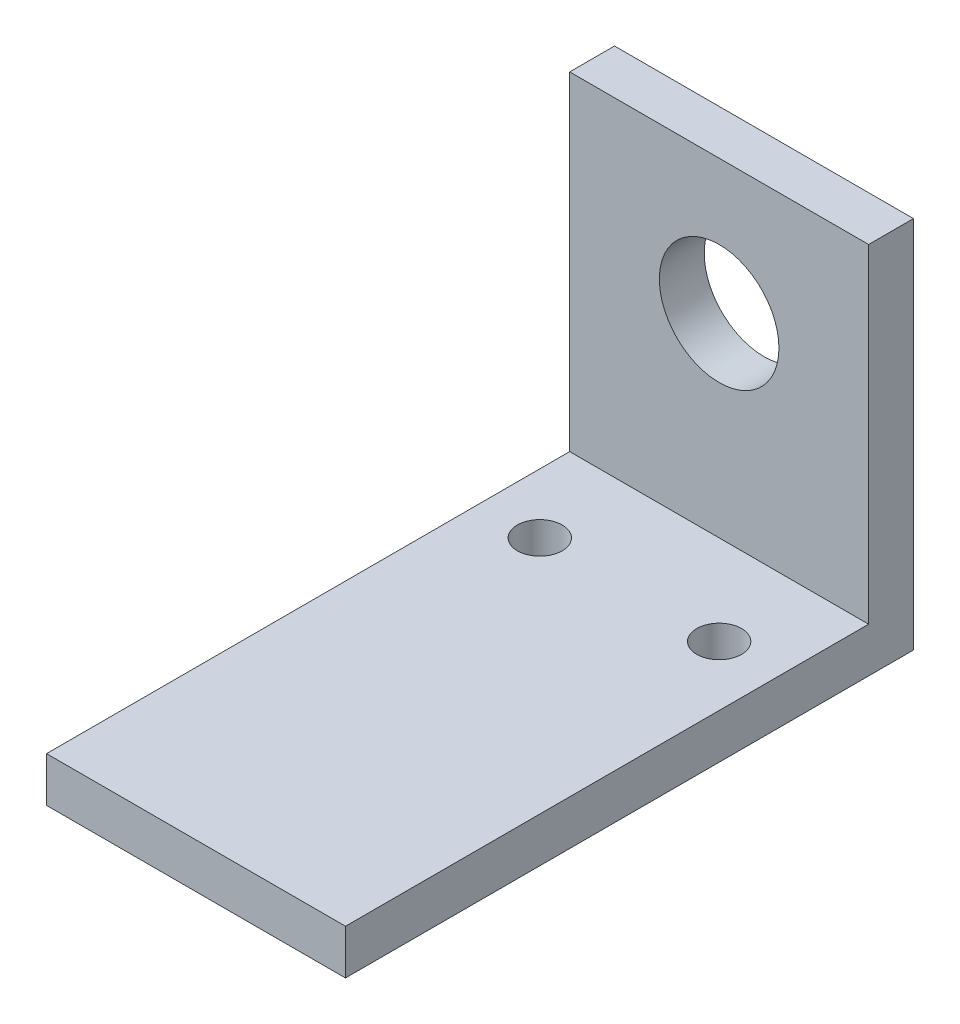
from build123d import *

# Parameters (mm, degrees)
EXTRUDE_1_DEPTH     = 20
CUT_EXTRUDE_1_REACH = 47.924
SKETCH_2_R          = 4
CUT_EXTRUDE_2_REACH = 47.924
SKETCH_3_R          = 1.5


with BuildPart() as part:
    # 草图1 → 凸台-拉伸1 (new body)
    with BuildSketch(Plane(origin=(0, 0, 0), x_dir=(0, 0, -1), z_dir=(1, 0, 0))):
        Polygon((0, 0), (0, 22), (3, 22), (3, -3), (-35, -3), (-35, 0), align=None)
    extrude(amount=EXTRUDE_1_DEPTH)

    # 草图2 → 切除-拉伸1 (cut, up to next)
    with BuildSketch(Plane.XY, mode=Mode.PRIVATE) as cut_extrude_1_sk1:
        with Locations((10, 13)):
            Circle(SKETCH_2_R)
    cut_extrude_1_tool1 = extrude(cut_extrude_1_sk1.sketch, amount=-CUT_EXTRUDE_1_REACH, mode=Mode.PRIVATE) & part.part
    add(cut_extrude_1_tool1.solids().sort_by_distance((10, 13, 0))[0], mode=Mode.SUBTRACT)

    # 草图3 → 切除-拉伸2 (cut, up to next)
    with BuildSketch(Plane(origin=(0, 0, 0), x_dir=(1, 0, 0), z_dir=(0, 1, 0)), mode=Mode.PRIVATE) as cut_extrude_2_sk1:
        with Locations(Location((4, -6, 0), (0, 0, 270))):
            Circle(SKETCH_3_R)
    cut_extrude_2_tool1 = extrude(cut_extrude_2_sk1.sketch, amount=-CUT_EXTRUDE_2_REACH, mode=Mode.PRIVATE) & part.part
    # 草图3 → 切除-拉伸2 (cut, up to next)
    with BuildSketch(Plane(origin=(0, 0, 0), x_dir=(1, 0, 0), z_dir=(0, 1, 0)), mode=Mode.PRIVATE) as cut_extrude_2_sk2:
        with Locations(Location((16, -6, 0), (0, 0, 270))):
            Circle(SKETCH_3_R)
    cut_extrude_2_tool2 = extrude(cut_extrude_2_sk2.sketch, amount=-CUT_EXTRUDE_2_REACH, mode=Mode.PRIVATE) & part.part
    add(cut_extrude_2_tool1.solids().sort_by_distance((4, 0, 6))[0], mode=Mode.SUBTRACT)
    add(cut_extrude_2_tool2.solids().sort_by_distance((16, 0, 6))[0], mode=Mode.SUBTRACT)


solid = part.part
